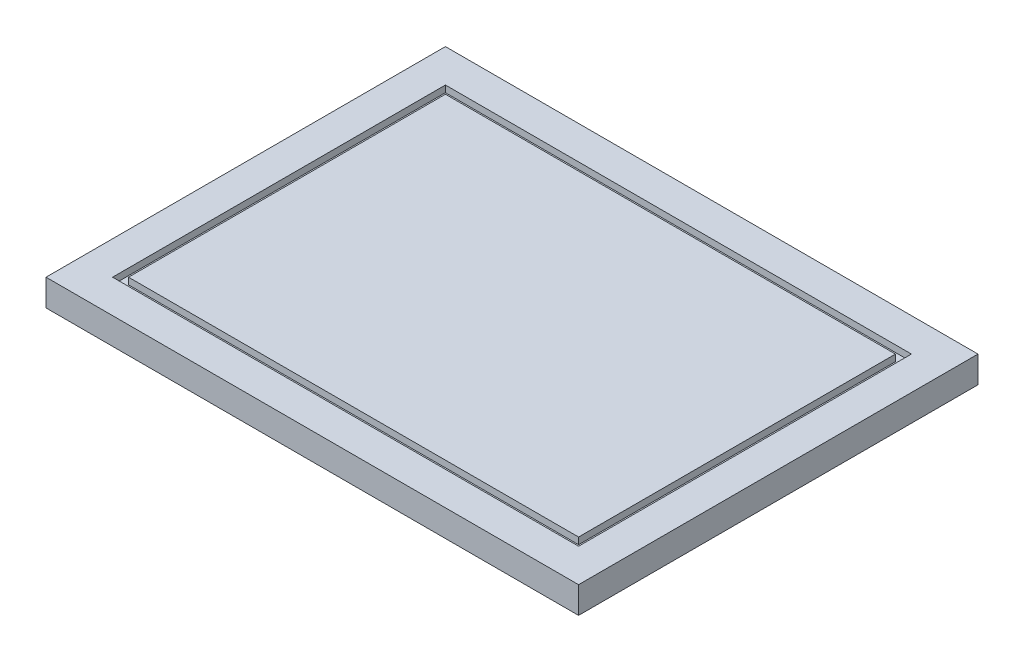
from build123d import *

# Parameters (mm, degrees)
SKETCH1_W           = 400
SKETCH1_H           = 300
BOSS_EXTRUDE1_DEPTH = 20
SKETCH2_W           = 350
SKETCH2_H           = 250
SKETCH2_W_2         = 338
SKETCH2_H_2         = 238
CUT_EXTRUDE1_DEPTH  = 5


with BuildPart() as part:
    # Sketch1 → Boss-Extrude1 (new body)
    with BuildSketch(Plane(origin=(0, 0, 0), x_dir=(1, 0, 0), z_dir=(0, 1, 0))):
        with Locations((200, 150)):
            Rectangle(SKETCH1_W, SKETCH1_H)
    extrude(amount=BOSS_EXTRUDE1_DEPTH)

    # Sketch2 → Cut-Extrude1 (cut)
    with BuildSketch(Plane(origin=(0, 20, 0), x_dir=(1, 0, 0), z_dir=(0, 1, 0))):
        with Locations((200, 150)):
            Rectangle(SKETCH2_W, SKETCH2_H)
        with Locations((200, 150)):
            Rectangle(SKETCH2_W_2, SKETCH2_H_2, mode=Mode.SUBTRACT)
    extrude(amount=-CUT_EXTRUDE1_DEPTH, mode=Mode.SUBTRACT)


solid = part.part
